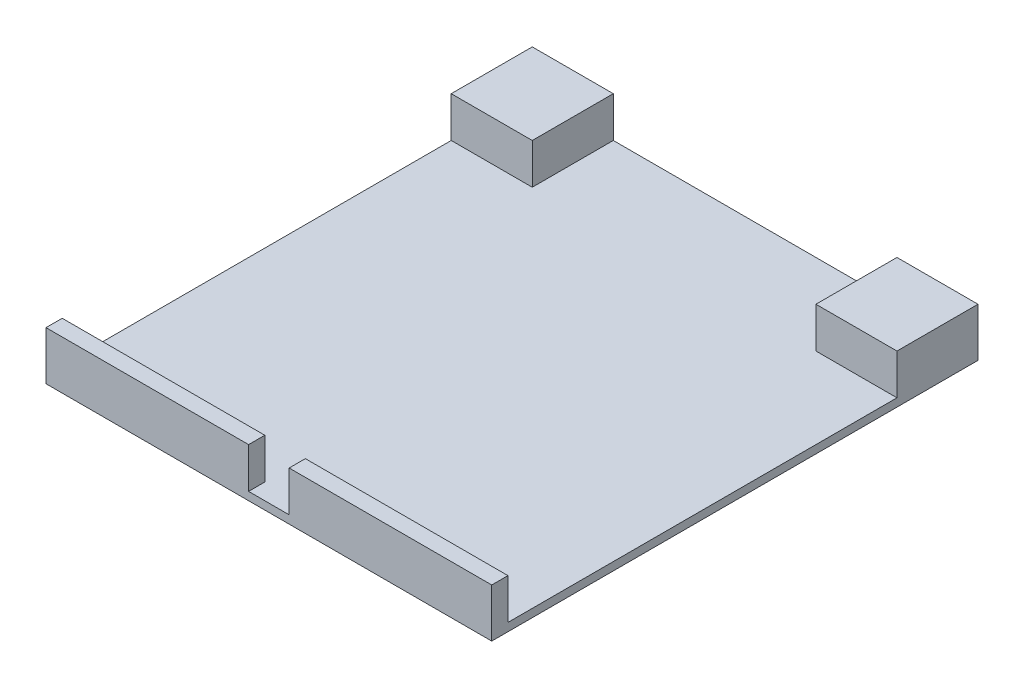
from build123d import *

# Parameters (mm, degrees)
SKETCH1_W           = 69.85
SKETCH1_H           = 76.2
BOSS_EXTRUDE1_DEPTH = 1.27
SKETCH2_W           = 12.7
SKETCH2_H           = 12.7
SKETCH2_W_2         = 31.75
SKETCH2_H_2         = 2.54
BOSS_EXTRUDE2_DEPTH = 6.35


with BuildPart() as part:
    # Sketch1 → Boss-Extrude1 (new body)
    with BuildSketch(Plane(origin=(0, 0, 0), x_dir=(1, 0, 0), z_dir=(0, 1, 0))):
        Rectangle(SKETCH1_W, SKETCH1_H)
    extrude(amount=BOSS_EXTRUDE1_DEPTH)

    # Sketch2 → Boss-Extrude2 (add)
    with BuildSketch(Plane(origin=(0, 1.27, 0), x_dir=(1, 0, 0), z_dir=(0, 1, 0))):
        with Locations((-28.575, 31.75)):
            Rectangle(SKETCH2_W, SKETCH2_H)
        with Locations((28.575, 31.75)):
            Rectangle(SKETCH2_W, SKETCH2_H)
        with Locations((19.05, -36.83)):
            Rectangle(SKETCH2_W_2, SKETCH2_H_2)
        with Locations((-19.05, -36.83)):
            Rectangle(SKETCH2_W_2, SKETCH2_H_2)
    extrude(amount=BOSS_EXTRUDE2_DEPTH)


solid = part.part
